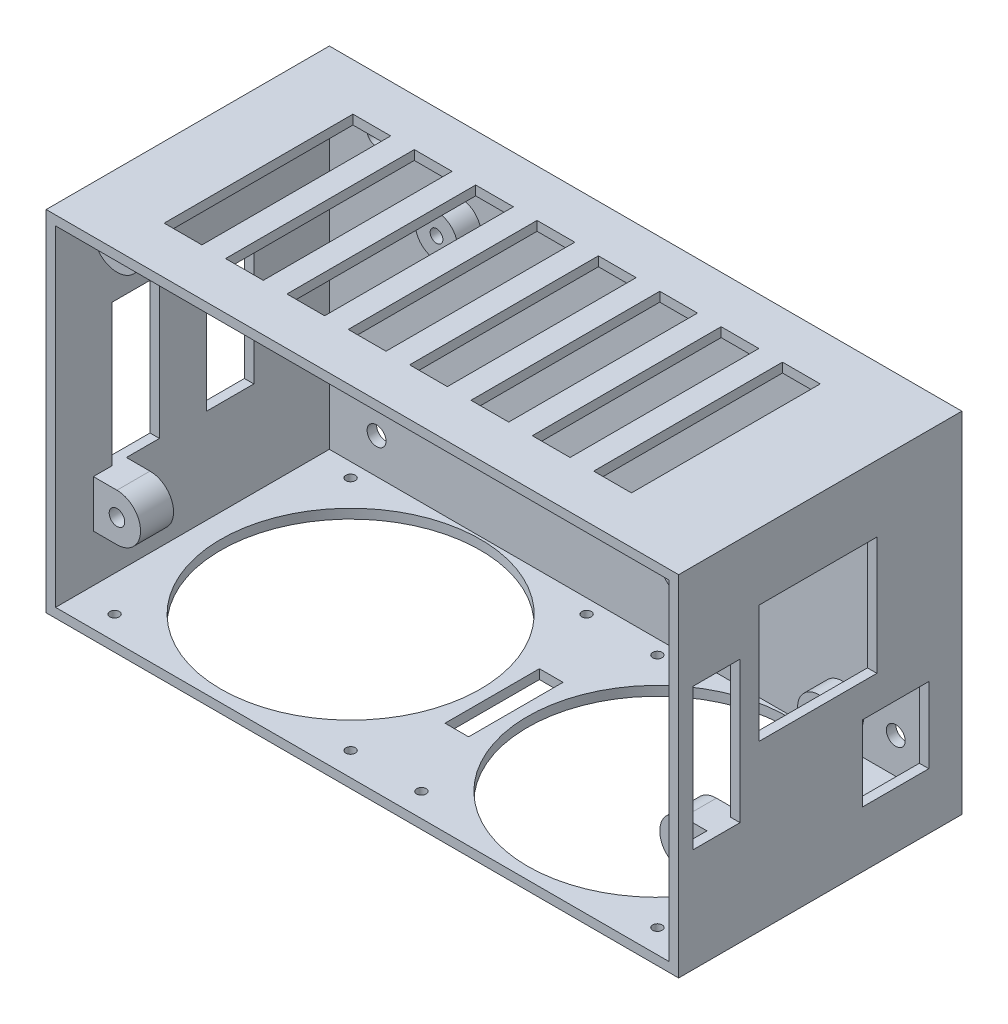
from build123d import *
from build123d.topology import SkipClean

# Parameters (mm, degrees)
ESBO_O1_W                  = 134
ESBO_O1_H                  = 74
ESBO_O1_W_2                = 130
ESBO_O1_H_2                = 70
RESSALTO_EXTRUS_O1_DEPTH   = 60
ESBO_O2_W                  = 134
ESBO_O2_H                  = 74
ESBO_O2_R                  = 2
RESSALTO_EXTRUS_O2_DEPTH   = 2
ESBO_O3_W                  = 25
ESBO_O3_H                  = 25
ESBO_O3_W_2                = 14
ESBO_O3_H_2                = 16
ESBO_O3_W_3                = 10
ESBO_O3_H_3                = 30
USB_FONTE_DEPTH            = 10
SAIDA_START                = -20
ESBO_O6_W                  = 8
ESBO_O6_H                  = 40
SAIDA_DE_AR_DEPTH          = 97.468879964
ESBO_O7_W                  = 10
ESBO_O7_H                  = 30
DISPLAY_DEPTH              = 12
ESBO_O8_R                  = 4.5
ESBO_O8_R_2                = 1.35
RESSALTO_EXTRUS_O3_DEPTH   = 5
ESBO_O8_3_R                = 1.35
CORTE_EXTRUS_O4_DEPTH      = 97.031244915
CORTE_EXTRUS_O5_DEPTH      = 2
CORTE_EXTRUS_O5_DEPTH_BACK = 10
ESBO_O9_R                  = 3
COOLER_START               = -72
ESBO_O10_R                 = 27.5
ESBO_O10_R_2               = 1
ESBO_O10_W                 = 5
ESBO_O10_H                 = 20
COOLER_DEPTH               = 45.468879964
RESSALTO_EXTRUS_O4_START   = -8
ESBO_O11_R                 = 1.65
RESSALTO_EXTRUS_O4_DEPTH   = 7


with BuildPart() as part:
    # Esboço1 → Ressalto-extrusão1 (new body)
    with BuildSketch(Plane.XY):
        Rectangle(ESBO_O1_W, ESBO_O1_H)
        Rectangle(ESBO_O1_W_2, ESBO_O1_H_2, mode=Mode.SUBTRACT)
    extrude(amount=RESSALTO_EXTRUS_O1_DEPTH)

    # Esboço2 → Ressalto-extrusão2 (add)
    with BuildSketch(Plane(origin=(0, 0, 0), x_dir=(-1, 0, 0), z_dir=(0, 0, -1))):
        Rectangle(ESBO_O2_W, ESBO_O2_H)
        with Locations((-55, -27.5)):
            Circle(ESBO_O2_R, mode=Mode.SUBTRACT)
        with Locations((55, -27.5)):
            Circle(ESBO_O2_R, mode=Mode.SUBTRACT)
        with Locations((55, 27.5)):
            Circle(ESBO_O2_R, mode=Mode.SUBTRACT)
        with Locations((-55, 27.5)):
            Circle(ESBO_O2_R, mode=Mode.SUBTRACT)
    extrude(amount=-RESSALTO_EXTRUS_O2_DEPTH)

    # Esboço3 → USB + fonte (cut)
    with BuildSketch(Plane(origin=(67, 0, 0), x_dir=(0, 0, -1), z_dir=(1, 0, 0))):
        with Locations((-30.5, 10.4)):
            Rectangle(ESBO_O3_W, ESBO_O3_H)
        with Locations((-14, -17.1)):
            Rectangle(ESBO_O3_W_2, ESBO_O3_H_2)
        with Locations((-52, 0)):
            Rectangle(ESBO_O3_W_3, ESBO_O3_H_3)
    extrude(amount=-USB_FONTE_DEPTH, mode=Mode.SUBTRACT)

    # Esboço6 → saida de ar (cut, through all)
    with BuildSketch(Plane.XZ.offset(37).offset(SAIDA_START)):
        with Locations((-48, 30)):
            Rectangle(ESBO_O6_W, ESBO_O6_H)
        with Locations((-35, 30)):
            Rectangle(ESBO_O6_W, ESBO_O6_H)
        with Locations((-22, 30)):
            Rectangle(ESBO_O6_W, ESBO_O6_H)
        with Locations((-9, 30)):
            Rectangle(ESBO_O6_W, ESBO_O6_H)
        with Locations((4, 30)):
            Rectangle(ESBO_O6_W, ESBO_O6_H)
        with Locations((17, 30)):
            Rectangle(ESBO_O6_W, ESBO_O6_H)
        with Locations((30, 30)):
            Rectangle(ESBO_O6_W, ESBO_O6_H)
        with Locations((43, 30)):
            Rectangle(ESBO_O6_W, ESBO_O6_H)
    extrude(amount=-SAIDA_DE_AR_DEPTH, mode=Mode.SUBTRACT)

    # Esboço7 → display (cut)
    with BuildSketch(Plane.ZY.offset(67)):
        with Locations((43, 0)):
            Rectangle(ESBO_O7_W, ESBO_O7_H)
        with Locations((23, 0)):
            Rectangle(ESBO_O7_W, ESBO_O7_H)
    extrude(amount=-DISPLAY_DEPTH, mode=Mode.SUBTRACT)

    # Esboço8 → Ressalto-extrusão3 (add)
    # profile 1 of 3: a face of its own
    with BuildSketch(Plane(origin=(0, 0, 2), x_dir=(-1, 0, 0), z_dir=(0, 0, -1))):
        with Locations(Location((37.3, 20.5, 0), (0, 0, 180))):
            Circle(ESBO_O8_R)
        with Locations(Location((37.3, 20.5, 0), (0, 0, 180))):
            Circle(ESBO_O8_R_2, mode=Mode.SUBTRACT)
    # profile 2 of 3: a face of its own
    with BuildSketch(Plane(origin=(0, 0, 2), x_dir=(-1, 0, 0), z_dir=(0, 0, -1))):
        with Locations(Location((-45, 20.5, 0), (0, 0, 180))):
            Circle(ESBO_O8_R)
        with Locations(Location((-45, 20.5, 0), (0, 0, 180))):
            Circle(ESBO_O8_R_2, mode=Mode.SUBTRACT)
    # profile 3 of 3: a face of its own
    with BuildSketch(Plane(origin=(0, 0, 2), x_dir=(-1, 0, 0), z_dir=(0, 0, -1))):
        with Locations(Location((-43.7, -27.67, 0), (0, 0, 180))):
            Circle(ESBO_O8_R)
        with Locations(Location((-43.7, -27.67, 0), (0, 0, 180))):
            Circle(ESBO_O8_R_2, mode=Mode.SUBTRACT)
    extrude(amount=-RESSALTO_EXTRUS_O3_DEPTH)

    # Esboço8<3> → Corte-extrusão4 (cut, through all)
    with SkipClean():  # the faces are left unmerged after this step: merging them gives an invalid solid
        with BuildSketch(Plane(origin=(0, 0, 2), x_dir=(-1, 0, 0), z_dir=(0, 0, -1))):
            with Locations((-43.7, -27.67)):
                Circle(ESBO_O8_3_R)
            with Locations((37.3, 20.5)):
                Circle(ESBO_O8_3_R)
            with Locations((-45, 20.5)):
                Circle(ESBO_O8_3_R)
        extrude(amount=CORTE_EXTRUS_O4_DEPTH, mode=Mode.SUBTRACT)

    # Esboço9 → Corte-extrusão5 (cut, two sides: drawn at the far end of the back side and taken through both)
    with BuildSketch(Plane.XY.offset(2).offset(-CORTE_EXTRUS_O5_DEPTH_BACK)):
        with Locations((45, 20.5)):
            Circle(ESBO_O9_R)
        with Locations((43.7, -27.67)):
            Circle(ESBO_O9_R)
        with Locations((-37.3, 20.5)):
            Circle(ESBO_O9_R)
    extrude(amount=CORTE_EXTRUS_O5_DEPTH + CORTE_EXTRUS_O5_DEPTH_BACK, mode=Mode.SUBTRACT)

    # Esboço10 → cooler (cut, through all)
    with BuildSketch(Plane(origin=(0, 37, 0), x_dir=(1, 0, 0), z_dir=(0, 1, 0)).offset(COOLER_START)):
        with Locations(Location((32.5, -30, 0), (0, 0, 270))):
            Circle(ESBO_O10_R)
        with Locations(Location((-32.5, -30, 0), (0, 0, 270))):
            Circle(ESBO_O10_R)
        with Locations(Location((-57.5, -55, 0), (0, 0, 270))):
            Circle(ESBO_O10_R_2)
        with Locations(Location((-7.5, -55, 0), (0, 0, 270))):
            Circle(ESBO_O10_R_2)
        with Locations(Location((7.5, -55, 0), (0, 0, 270))):
            Circle(ESBO_O10_R_2)
        with Locations(Location((57.5, -55, 0), (0, 0, 270))):
            Circle(ESBO_O10_R_2)
        with Locations(Location((57.5, -5, 0), (0, 0, 270))):
            Circle(ESBO_O10_R_2)
        with Locations(Location((7.5, -5, 0), (0, 0, 270))):
            Circle(ESBO_O10_R_2)
        with Locations(Location((-7.5, -5, 0), (0, 0, 270))):
            Circle(ESBO_O10_R_2)
        with Locations(Location((-57.5, -5, 0), (0, 0, 270))):
            Circle(ESBO_O10_R_2)
        with Locations((0, -30)):
            Rectangle(ESBO_O10_W, ESBO_O10_H)
    extrude(amount=-COOLER_DEPTH, mode=Mode.SUBTRACT)

    # Esboço11 → Ressalto-extrusão4 (add)
    # profile 1 of 4: a face of its own
    with BuildSketch(Plane.XY.offset(60).offset(RESSALTO_EXTRUS_O4_START)):
        with BuildLine():
            Line((65, -25), (60, -25))
            ThreePointArc((60, -25), (55, -20), (60, -15))
            Line((60, -15), (65, -15))
            Line((65, -15), (65, -25))
        make_face()
        with Locations((60, -20)):
            Circle(ESBO_O11_R, mode=Mode.SUBTRACT)
    # profile 2 of 4: a face of its own
    with BuildSketch(Plane.XY.offset(60).offset(RESSALTO_EXTRUS_O4_START)):
        with BuildLine():
            Line((65, 35), (60, 35))
            ThreePointArc((60, 35), (56.464466094, 26.464466094), (65, 30))
            Line((65, 30), (65, 35))
        make_face()
        with Locations((60, 30)):
            Circle(ESBO_O11_R, mode=Mode.SUBTRACT)
    # profile 3 of 4: a face of its own
    with BuildSketch(Plane.XY.offset(60).offset(RESSALTO_EXTRUS_O4_START)):
        with BuildLine():
            Line((-65, -25), (-65, -15))
            Line((-65, -15), (-60, -15))
            ThreePointArc((-60, -15), (-55, -20), (-60, -25))
            Line((-60, -25), (-65, -25))
        make_face()
        with Locations((-60, -20)):
            Circle(ESBO_O11_R, mode=Mode.SUBTRACT)
    # profile 4 of 4: a face of its own
    with BuildSketch(Plane.XY.offset(60).offset(RESSALTO_EXTRUS_O4_START)):
        with BuildLine():
            Line((-60, 35), (-65, 35))
            Line((-65, 35), (-65, 30))
            ThreePointArc((-65, 30), (-56.464466094, 26.464466094), (-60, 35))
        make_face()
        with Locations((-60, 30)):
            Circle(ESBO_O11_R, mode=Mode.SUBTRACT)
    extrude(amount=-RESSALTO_EXTRUS_O4_DEPTH)


solid = part.part
